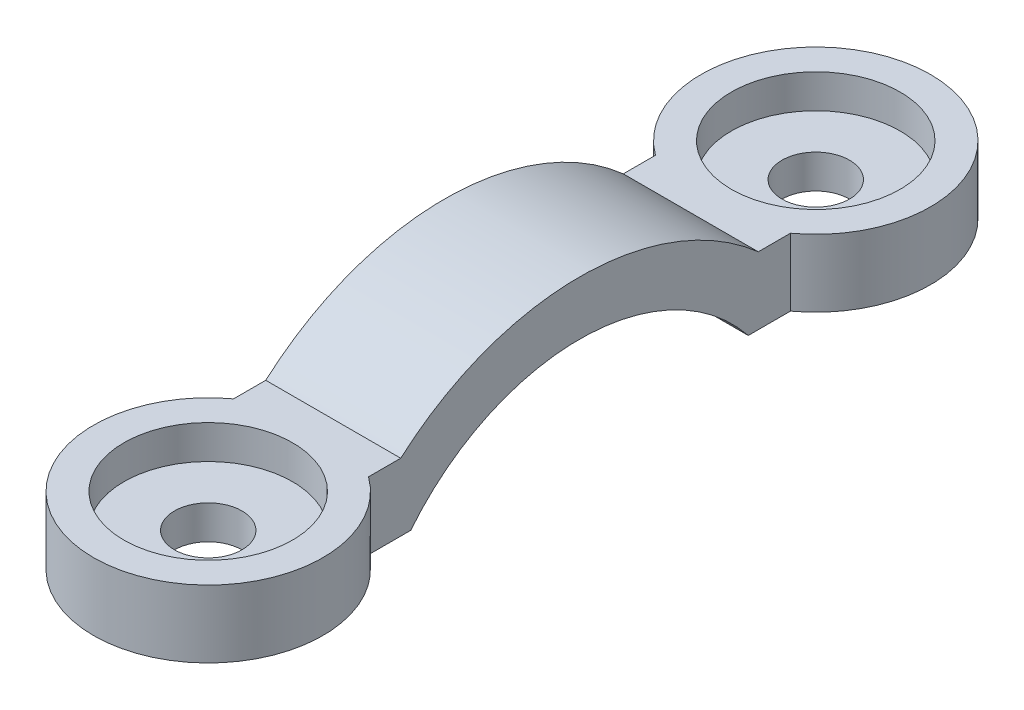
from build123d import *

# Parameters (mm, degrees)
BASE_DEPTH           = 10
ESQUISSE5_R          = 2.5
VIDE_ACCES_VIS_DEPTH = 31.929020524
BOSS_START           = -5
ESQUISSE6_R          = 8.5
ESQUISSE6_R_2        = 2.587391516
ESQUISSE6_R_3        = 2.5
BOSS_VIS_DEPTH       = 5
ESQUISSE7_R          = 6.25
VIDE_ECROU_DEPTH     = 2.5


with BuildPart() as part:
    # Esquisse2 → BASE (new body)
    with BuildSketch(Plane(origin=(0, 0, 0), x_dir=(0, 0, -1), z_dir=(1, 0, 0))):
        with BuildLine():
            Line((-27.502803686, 10), (-14.361406616, 10))
            Line((-14.361406616, 10), (-12.502803686, 10))
            ThreePointArc((-12.502803686, 10), (0, 16.01), (12.502803686, 10))
            Line((12.502803686, 10), (14.361406616, 10))
            Line((14.361406616, 10), (22.502803686, 10))
            Line((22.502803686, 10), (27.502803686, 10))
            Line((27.502803686, 10), (27.502803686, 15))
            Line((27.502803686, 15), (13.24387028, 15))
            ThreePointArc((13.24387028, 15), (0, 20.01), (-13.24387028, 15))
            Line((-13.24387028, 15), (-27.502803686, 15))
            Line((-27.502803686, 15), (-27.502803686, 10))
        make_face()
    extrude(amount=BASE_DEPTH)

    # Esquisse5 → VIDE ACCES VIS (cut, through all)
    with BuildSketch(Plane.XZ.offset(-10)):
        with Locations(Location((5, 22.502803686, 0), (0, 0, 270))):
            Circle(ESQUISSE5_R)
        with Locations(Location((5, -22.502803686, 0), (0, 0, 270))):
            Circle(ESQUISSE5_R)
    extrude(amount=-VIDE_ACCES_VIS_DEPTH, mode=Mode.SUBTRACT)

    # Esquisse6 → BOSS VIS (add)
    # profile 1 of 2: a face of its own
    with BuildSketch(Plane(origin=(0, 15, 0), x_dir=(1, 0, 0), z_dir=(0, 1, 0)).offset(BOSS_START)):
        with Locations((5, 22.502803686)):
            Circle(ESQUISSE6_R)
        with Locations((5, 22.502803686)):
            Circle(ESQUISSE6_R_2, mode=Mode.SUBTRACT)
    # profile 2 of 2: a face of its own
    with BuildSketch(Plane(origin=(0, 15, 0), x_dir=(1, 0, 0), z_dir=(0, 1, 0)).offset(BOSS_START)):
        with Locations((5, -22.502803686)):
            Circle(ESQUISSE6_R)
        with Locations(Location((5, -22.502803686, 0), (0, 0, 90))):
            Circle(ESQUISSE6_R_3, mode=Mode.SUBTRACT)
    extrude(amount=BOSS_VIS_DEPTH)

    # Esquisse7 → VIDE ECROU (cut)
    with BuildSketch(Plane(origin=(0, 15, 0), x_dir=(1, 0, 0), z_dir=(0, 1, 0))):
        with Locations(Location((5, 22.502803686, 0), (0, 0, 270))):
            Circle(ESQUISSE7_R)
        with Locations(Location((5, -22.502803686, 0), (0, 0, 270))):
            Circle(ESQUISSE7_R)
    extrude(amount=-VIDE_ECROU_DEPTH, mode=Mode.SUBTRACT)


solid = part.part
